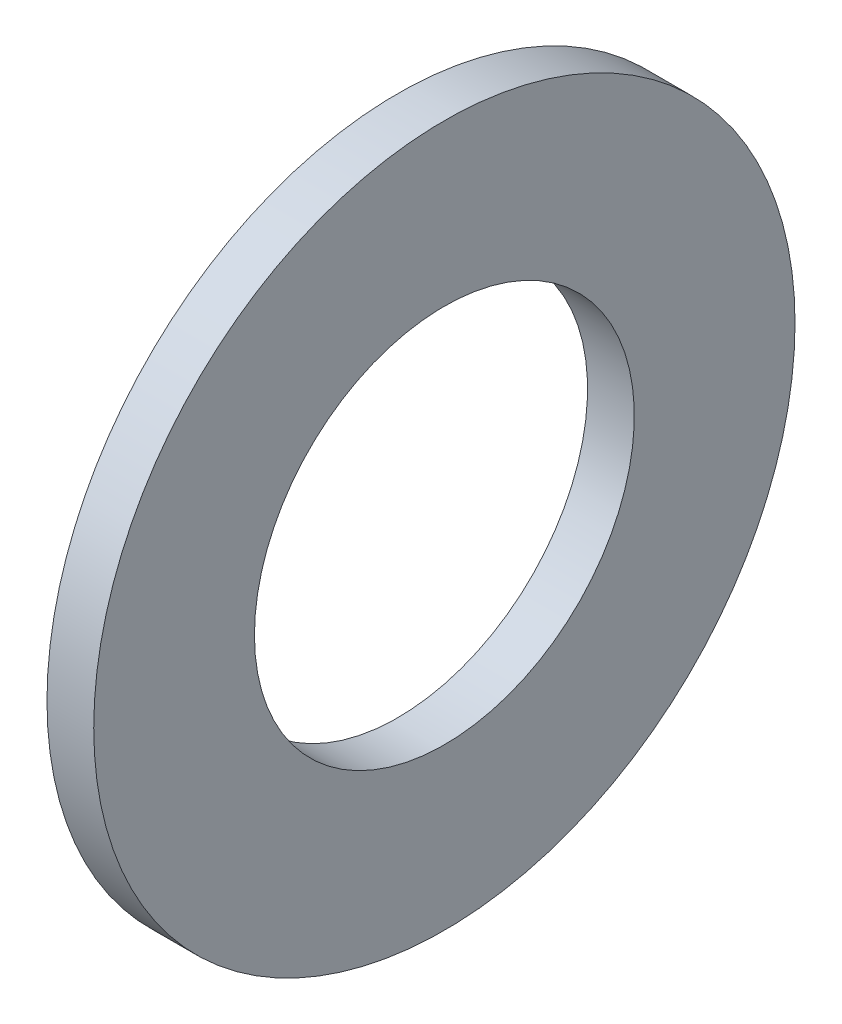
from build123d import *

# Parameters (mm, degrees)
SKETCH1_W = 0.8
SKETCH1_H = 2.75


with BuildPart() as part:
    # Sketch1 → Base-Revolve (revolve)
    with BuildSketch(Plane.XY, mode=Mode.PRIVATE) as base_revolve_sk:
        with Locations((-0.4, 4.625)):
            Rectangle(SKETCH1_W, SKETCH1_H)
    revolve(base_revolve_sk.sketch.rotate(Axis((-34.925, 0, 0), (1, 0, 0)), 90), axis=Axis((-34.925, 0, 0), (1, 0, 0)))


solid = part.part
